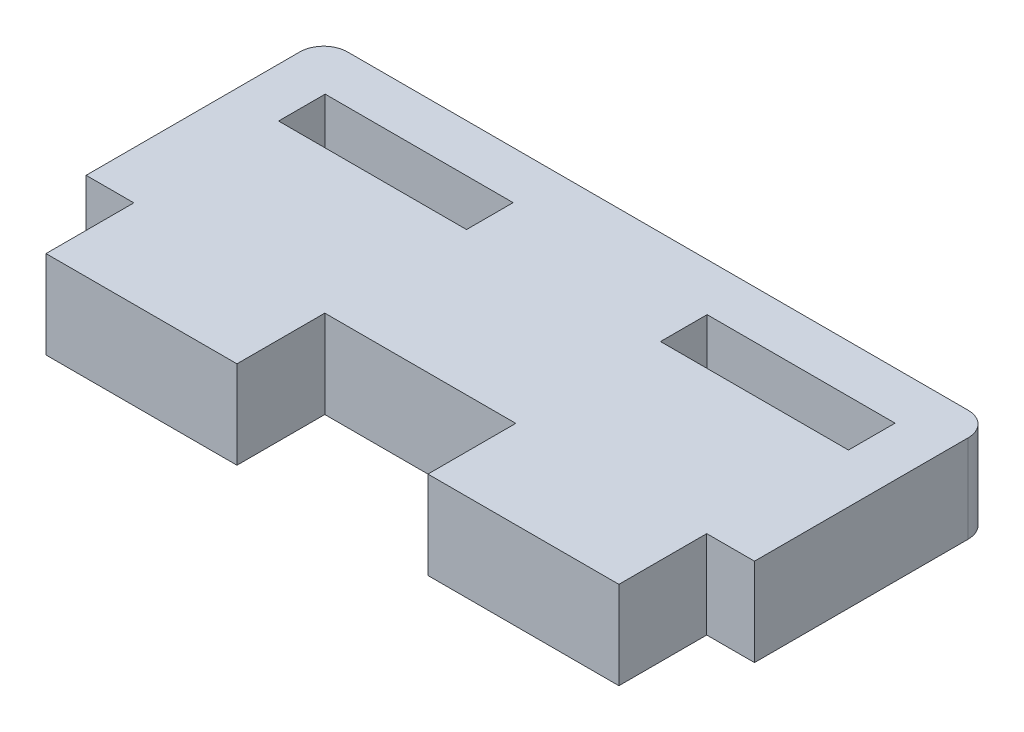
from build123d import *

# Parameters (mm, degrees)
SKETCH1_W           = 12.5
SKETCH1_H           = 3.0988
BOSS_EXTRUDE1_DEPTH = 5.842
FILLET1_R           = 1.5875


with BuildPart() as part:
    # Sketch1 → Boss-Extrude1 (new body)
    with BuildSketch(Plane(origin=(0, 0, 0), x_dir=(1, 0, 0), z_dir=(0, 1, 0))):
        Polygon((22.225, -4.7625), (19.05, -4.7625), (19.05, -10.6045), (6.35, -10.6045), (6.35, -4.7625), (-6.35, -4.7625), (-6.35, -10.6045), (-19.05, -10.6045), (-19.05, -4.7625), (-22.225, -4.7625), (-22.225, 4.7625), (-22.225, 7.8613), (-22.225, 11.0363), (22.225, 11.0363), (22.225, 7.8613), (22.225, 4.7625), align=None)
        with Locations((12.7, 6.3119)):
            Rectangle(SKETCH1_W, SKETCH1_H, mode=Mode.SUBTRACT)
        with Locations((-12.7, 6.3119)):
            Rectangle(SKETCH1_W, SKETCH1_H, mode=Mode.SUBTRACT)
    extrude(amount=BOSS_EXTRUDE1_DEPTH)

    # Fillet1
    fillet1_edges = [part.edges().sort_by_distance(p)[0] for p in [
        (-22.225, 2.921, -11.0363),
        (22.225, 2.921, -11.0363),
    ]]
    fillet(fillet1_edges, radius=FILLET1_R)


solid = part.part
